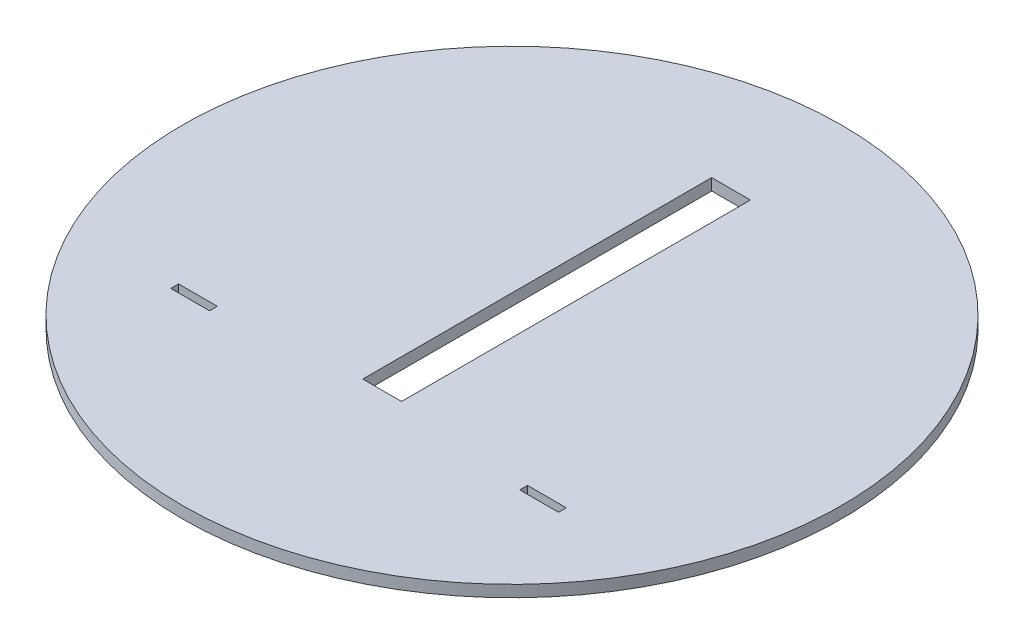
from build123d import *

# Parameters (mm, degrees)
SKETCH1_R           = 8.5
BOSS_EXTRUDE1_DEPTH = 0.15
CUT_EXTRUDE1_REACH  = 14.025
SKETCH2_W           = 1
SKETCH2_H           = 9
SKETCH2_H_2         = 0.2


with BuildPart() as part:
    # Sketch1 → Boss-Extrude1 (new, symmetric)
    with BuildSketch(Plane(origin=(0, 0, 0), x_dir=(1, 0, 0), z_dir=(0, 1, 0))):
        with Locations(Location((0, 0, 0), (0, 0, 270))):
            Circle(SKETCH1_R)
    extrude(amount=BOSS_EXTRUDE1_DEPTH, both=True)

    # Sketch2 → Cut-Extrude1 (cut, up to next)
    with BuildSketch(Plane(origin=(0, 0.15, 0), x_dir=(1, 0, 0), z_dir=(0, 1, 0)), mode=Mode.PRIVATE) as cut_extrude1_sk1:
        with Locations((0, 1.15)):
            Rectangle(SKETCH2_W, SKETCH2_H)
    cut_extrude1_tool1 = extrude(cut_extrude1_sk1.sketch, amount=-CUT_EXTRUDE1_REACH, mode=Mode.PRIVATE) & part.part
    # Sketch2 → Cut-Extrude1 (cut, up to next)
    with BuildSketch(Plane(origin=(0, 0.15, 0), x_dir=(1, 0, 0), z_dir=(0, 1, 0)), mode=Mode.PRIVATE) as cut_extrude1_sk2:
        with Locations((4.5, -3.7)):
            Rectangle(SKETCH2_W, SKETCH2_H_2)
    cut_extrude1_tool2 = extrude(cut_extrude1_sk2.sketch, amount=-CUT_EXTRUDE1_REACH, mode=Mode.PRIVATE) & part.part
    # Sketch2 → Cut-Extrude1 (cut, up to next)
    with BuildSketch(Plane(origin=(0, 0.15, 0), x_dir=(1, 0, 0), z_dir=(0, 1, 0)), mode=Mode.PRIVATE) as cut_extrude1_sk3:
        with Locations((-4.5, -3.7)):
            Rectangle(SKETCH2_W, SKETCH2_H_2)
    cut_extrude1_tool3 = extrude(cut_extrude1_sk3.sketch, amount=-CUT_EXTRUDE1_REACH, mode=Mode.PRIVATE) & part.part
    add(cut_extrude1_tool1.solids().sort_by_distance((0, 0.15, -1.15))[0], mode=Mode.SUBTRACT)
    add(cut_extrude1_tool2.solids().sort_by_distance((4.5, 0.15, 3.7))[0], mode=Mode.SUBTRACT)
    add(cut_extrude1_tool3.solids().sort_by_distance((-4.5, 0.15, 3.7))[0], mode=Mode.SUBTRACT)


solid = part.part
